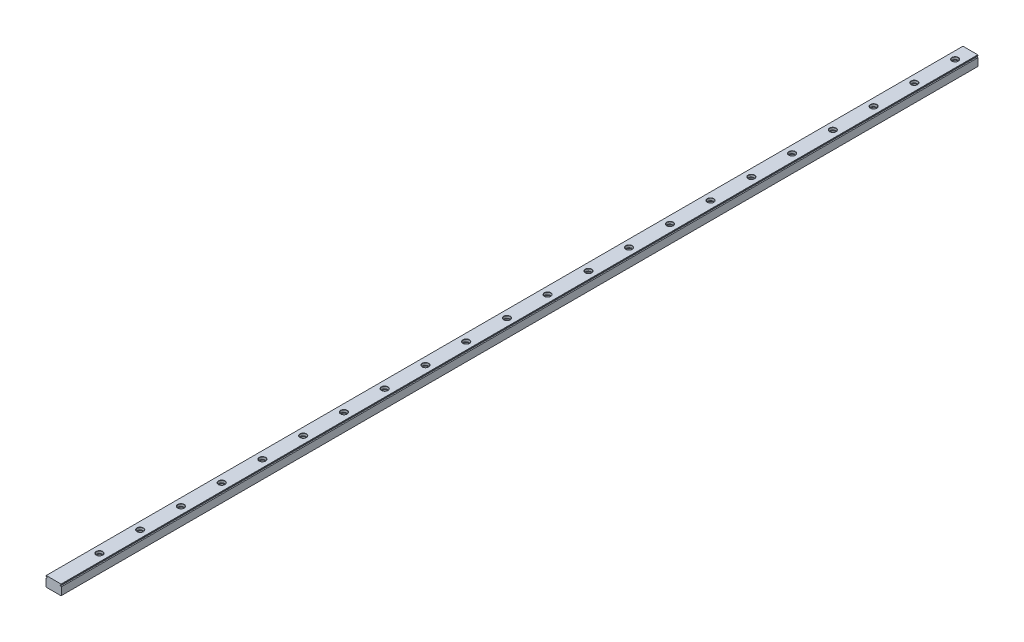
from build123d import *

# Parameters (mm, degrees)
EXTRUDE1_DEPTH             = 900
EXTRUDE2_REACH             = 902.087
SKETCH2_R                  = 2.25
SKETCH_R                   = 3
SKETCH_R_2                 = 2.25
EXTRUDE4_DEPTH             = 2.3
CHAMFER1_SIZE              = 0.2
LPATTERN1_COUNT            = 22
LPATTERN1_PITCH            = 40
CHAMFER1_OF_LPATTERN1_SIZE = 0.2


with BuildPart() as part:
    # Sketch1 → Extrude1 (new body)
    with BuildSketch(Plane.XY):
        with BuildLine():
            Line((-7.3, -5), (7.3, -5))
            Line((7.3, -5), (7.5, -4.8))
            Line((7.5, -4.8), (7.5, 2.706274607))
            ThreePointArc((7.5, 2.706274607), (7.091294745, 2.882570681), (6.840065792, 3.25))
            Line((6.840065792, 3.25), (6.340065792, 3.25))
            Line((6.340065792, 3.25), (6.340065792, 3.75))
            Line((6.340065792, 3.75), (6.840065792, 3.75))
            ThreePointArc((6.840065792, 3.75), (7.091294745, 4.117429319), (7.5, 4.293725393))
            Line((7.5, 4.293725393), (7.5, 4.8))
            Line((7.5, 4.8), (7.3, 5))
            Line((7.3, 5), (-7.3, 5))
            Line((-7.3, 5), (-7.5, 4.8))
            Line((-7.5, 4.8), (-7.5, 4.293725393))
            ThreePointArc((-7.5, 4.293725393), (-7.091294745, 4.117429319), (-6.840065792, 3.75))
            Line((-6.840065792, 3.75), (-6.340065792, 3.75))
            Line((-6.340065792, 3.75), (-6.340065792, 3.25))
            Line((-6.340065792, 3.25), (-6.840065792, 3.25))
            ThreePointArc((-6.840065792, 3.25), (-7.091294745, 2.882570681), (-7.5, 2.706274607))
            Line((-7.5, 2.706274607), (-7.5, -4.8))
            Line((-7.5, -4.8), (-7.3, -5))
        make_face()
    extrude(amount=EXTRUDE1_DEPTH)

    # Sketch2 → Extrude2 (cut, up to next)
    with BuildSketch(Plane(origin=(0, 5, 0), x_dir=(1, 0, 0), z_dir=(0, 1, 0)), mode=Mode.PRIVATE) as extrude2_sk1:
        with Locations((0, -15)):
            Circle(SKETCH2_R)
    extrude2_tool1 = extrude(extrude2_sk1.sketch, amount=-EXTRUDE2_REACH, mode=Mode.PRIVATE) & part.part
    extrude2 = extrude2_tool1.solids().sort_by_distance((0, 5, 15))[0]
    add(extrude2, mode=Mode.SUBTRACT)

    # Sketch → Extrude4 (cut)
    with BuildSketch(Plane(origin=(0, 5, 0), x_dir=(1, 0, 0), z_dir=(0, 1, 0))):
        with Locations((0, -15)):
            Circle(SKETCH_R)
        with Locations((0, -15)):
            Circle(SKETCH_R_2, mode=Mode.SUBTRACT)
    extrude4 = extrude(amount=-EXTRUDE4_DEPTH, mode=Mode.SUBTRACT)

    # Chamfer1
    chamfer1_edges = [part.edges().sort_by_distance(p)[0] for p in [
        (-2.25, -5, 15),
        (-3, 5, 15),
    ]]
    chamfer(chamfer1_edges, length=CHAMFER1_SIZE)

    # LPattern1: Extrude2, Extrude4 ×22
    with Locations(*[(0, 0, i * LPATTERN1_PITCH) for i in range(1, LPATTERN1_COUNT)]):
        add(extrude2, mode=Mode.SUBTRACT)
        add(extrude4, mode=Mode.SUBTRACT)

    # Chamfer1 of LPattern1
    chamfer1_of_lpattern1_edges = [part.edges().sort_by_distance(p)[0] for p in [
        (-2.25, -5, 55),
        (-3, 5, 55),
        (-2.25, -5, 95),
        (-3, 5, 95),
        (-2.25, -5, 135),
        (-3, 5, 135),
        (-2.25, -5, 175),
        (-3, 5, 175),
        (-2.25, -5, 215),
        (-3, 5, 215),
        (-2.25, -5, 255),
        (-3, 5, 255),
        (-2.25, -5, 295),
        (-3, 5, 295),
        (-2.25, -5, 335),
        (-3, 5, 335),
        (-2.25, -5, 375),
        (-3, 5, 375),
        (-2.25, -5, 415),
        (-3, 5, 415),
        (-2.25, -5, 455),
        (-3, 5, 455),
        (-2.25, -5, 495),
        (-3, 5, 495),
        (-2.25, -5, 535),
        (-3, 5, 535),
        (-2.25, -5, 575),
        (-3, 5, 575),
        (-2.25, -5, 615),
        (-3, 5, 615),
        (-2.25, -5, 655),
        (-3, 5, 655),
        (-2.25, -5, 695),
        (-3, 5, 695),
        (-2.25, -5, 735),
        (-3, 5, 735),
        (-2.25, -5, 775),
        (-3, 5, 775),
        (-2.25, -5, 815),
        (-3, 5, 815),
        (-2.25, -5, 855),
        (-3, 5, 855),
    ]]
    chamfer(chamfer1_of_lpattern1_edges, length=CHAMFER1_OF_LPATTERN1_SIZE)


solid = part.part
